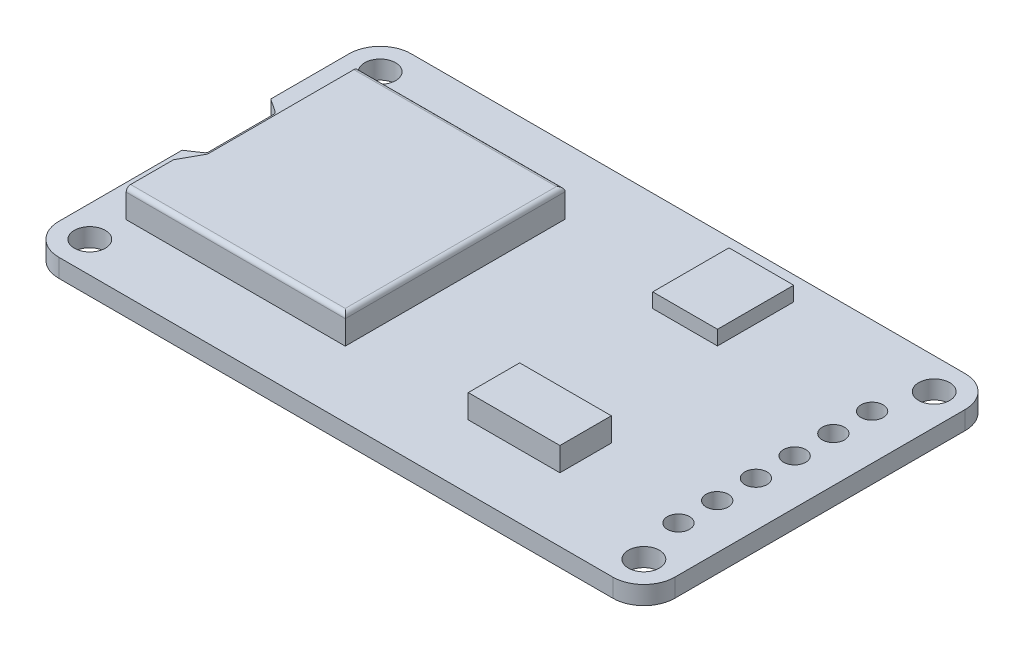
from build123d import *

# Parameters (mm, degrees)
ESQUISSE1_R                         = 1.05
PLAQUE_DEPTH                        = 1.24
CARTE_SD_DEPTH                      = 1.91
ESQUISSE4_W                         = 6.2
ESQUISSE4_H                         = 3.48
PUCE_DEPTH                          = 1.6
ESQUISSE7_W                         = 4.38
ESQUISSE7_H                         = 5.16
PUCE_2_DEPTH                        = 0.98
ESQUISSE8_R                         = 0.75
ENL_V_MAT_EXTRU_1_DEPTH             = 25.084021674
ESQUISSE9_W                         = 11.3
ESQUISSE9_H                         = 1.2
ENL_V_MAT_EXTRU_3_DEPTH             = 11.8
ENL_V_MAT_EXTRU_3_DIRECTION_2_REACH = 42.597
CONG_1_R                            = 0.3


with BuildPart() as part:
    # Esquisse1 → Plaque (new body)
    with BuildSketch(Plane(origin=(0, 0, 0), x_dir=(1, 0, 0), z_dir=(0, 1, 0))):
        with BuildLine():
            Line((-18.74, 11.92), (18.74, 11.92))
            ThreePointArc((18.74, 11.92), (20.22492424, 11.30492424), (20.84, 9.82))
            Line((20.84, 9.82), (20.84, -9.82))
            ThreePointArc((20.84, -9.82), (20.22492424, -11.30492424), (18.74, -11.92))
            Line((18.74, -11.92), (-18.74, -11.92))
            ThreePointArc((-18.74, -11.92), (-20.22492424, -11.30492424), (-20.84, -9.82))
            Line((-20.84, -9.82), (-20.84, -1.48))
            Line((-20.84, -1.48), (-19.951399946, -0.888062551))
            ThreePointArc((-19.951399946, -0.888062551), (-19.869602616, -0.798004209), (-19.84, -0.68))
            Line((-19.84, -0.68), (-19.84, 3.72))
            ThreePointArc((-19.84, 3.72), (-19.869602616, 3.838004209), (-19.951399946, 3.928062551))
            Line((-19.951399946, 3.928062551), (-20.84, 4.52))
            Line((-20.84, 4.52), (-20.84, 9.82))
            ThreePointArc((-20.84, 9.82), (-20.22492424, 11.30492424), (-18.74, 11.92))
        make_face()
        with Locations(Location((-18.74, 9.82, 0), (0, 0, 270))):
            Circle(ESQUISSE1_R, mode=Mode.SUBTRACT)
        with Locations(Location((18.74, 9.82, 0), (0, 0, 270))):
            Circle(ESQUISSE1_R, mode=Mode.SUBTRACT)
        with Locations(Location((-18.74, -9.82, 0), (0, 0, 270))):
            Circle(ESQUISSE1_R, mode=Mode.SUBTRACT)
        with Locations(Location((18.74, -9.82, 0), (0, 0, 270))):
            Circle(ESQUISSE1_R, mode=Mode.SUBTRACT)
    extrude(amount=PLAQUE_DEPTH)

    # Esquisse2 → Carte SD (add)
    with BuildSketch(Plane(origin=(0, 1.24, 0), x_dir=(1, 0, 0), z_dir=(0, 1, 0))):
        Polygon((-18.66, -7.44), (-3.84, -7.44), (-3.84, 7.44), (-17.84, 7.44), (-17.84, -2.756314418), (-18.66, -4.24), align=None)
    extrude(amount=CARTE_SD_DEPTH)

    # Esquisse4 → Puce (add)
    with BuildSketch(Plane(origin=(0, 1.24, 0), x_dir=(1, 0, 0), z_dir=(0, 1, 0))):
        with Locations((7.74, -5.86)):
            Rectangle(ESQUISSE4_W, ESQUISSE4_H)
    extrude(amount=PUCE_DEPTH)

    # Esquisse7 → Puce 2 (add)
    with BuildSketch(Plane(origin=(0, 1.24, 0), x_dir=(1, 0, 0), z_dir=(0, 1, 0))):
        with Locations((6.55, 7.74)):
            Rectangle(ESQUISSE7_W, ESQUISSE7_H)
    extrude(amount=PUCE_2_DEPTH)

    # Esquisse8 → Enlèv. mat.-Extru.1 (cut, through all)
    with BuildSketch(Plane(origin=(0, 1.24, 0), x_dir=(1, 0, 0), z_dir=(0, 1, 0))):
        with Locations(Location((17.79, 6.57, 0), (0, 0, 270))):
            Circle(ESQUISSE8_R)
        with Locations(Location((17.79, 3.95, 0), (0, 0, 270))):
            Circle(ESQUISSE8_R)
        with Locations(Location((17.79, 1.33, 0), (0, 0, 270))):
            Circle(ESQUISSE8_R)
        with Locations(Location((17.79, -1.29, 0), (0, 0, 270))):
            Circle(ESQUISSE8_R)
        with Locations(Location((17.79, -3.91, 0), (0, 0, 270))):
            Circle(ESQUISSE8_R)
        with Locations(Location((17.79, -6.53, 0), (0, 0, 270))):
            Circle(ESQUISSE8_R)
    extrude(amount=-ENL_V_MAT_EXTRU_1_DEPTH, mode=Mode.SUBTRACT)

    # Esquisse9 → Enlèv. mat.-Extru.3 (cut)
    with BuildSketch(Plane.ZY.offset(17.84)):
        with Locations((-0.92, 2.35)):
            Rectangle(ESQUISSE9_W, ESQUISSE9_H)
    extrude(amount=-ENL_V_MAT_EXTRU_3_DEPTH, mode=Mode.SUBTRACT)

    # Enlèv. mat.-Extru.3 direction 2: up to this face of the body (flat: up to its plane)
    enl_v_mat_extru_3_direction_2_end = Plane(part.part.faces().sort_by_distance((-18.66, 2.195, 5.84))[0])
    # Esquisse9 → Enlèv. mat.-Extru.3 direction 2 (cut, up to the picked face)
    with BuildSketch(Plane.ZY.offset(17.84), mode=Mode.PRIVATE) as enl_v_mat_extru_3_direction_2_sk1:
        with Locations((-0.92, 2.35)):
            Rectangle(ESQUISSE9_W, ESQUISSE9_H)
    enl_v_mat_extru_3_direction_2_tool1 = split(extrude(enl_v_mat_extru_3_direction_2_sk1.sketch, amount=ENL_V_MAT_EXTRU_3_DIRECTION_2_REACH, mode=Mode.PRIVATE), bisect_by=enl_v_mat_extru_3_direction_2_end, keep=Keep.BOTH, mode=Mode.PRIVATE)
    add(enl_v_mat_extru_3_direction_2_tool1.solids().sort_by(Axis((-17.84, 2.35, -0.92), (-1, 0, 0)))[0], mode=Mode.SUBTRACT)

    # Congé1
    cong_1_edges = [part.edges().sort_by_distance(p)[0] for p in [
        (-11.25, 3.15, 7.44),
        (-3.84, 3.15, 0),
        (-10.84, 3.15, -7.44),
    ]]
    fillet(cong_1_edges, radius=CONG_1_R)


solid = part.part
